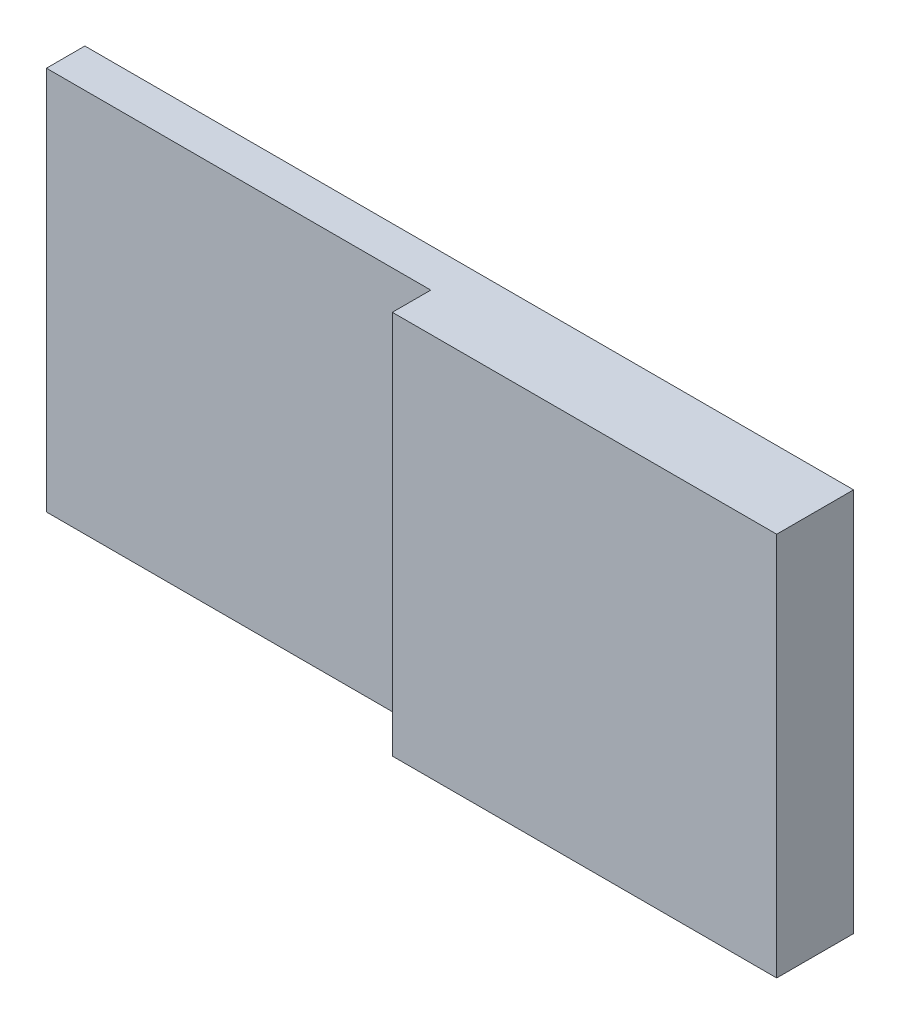
from build123d import *

# Parameters (mm, degrees)
SKETCH_1_W      = 200
SKETCH_1_H      = 100
EXTRUDE_1_DEPTH = 10
SKETCH_2_W      = 100
SKETCH_2_H      = 100
EXTRUDE_2_DEPTH = 10


with BuildPart() as part:
    # 草图1 → 凸台-拉伸1 (new body)
    with BuildSketch(Plane.XY):
        Rectangle(SKETCH_1_W, SKETCH_1_H)
    extrude(amount=EXTRUDE_1_DEPTH)

    # 草图2 → 凸台-拉伸2 (add)
    with BuildSketch(Plane.XY.offset(10)):
        with Locations((50, 0)):
            Rectangle(SKETCH_2_W, SKETCH_2_H)
    extrude(amount=EXTRUDE_2_DEPTH)


solid = part.part
